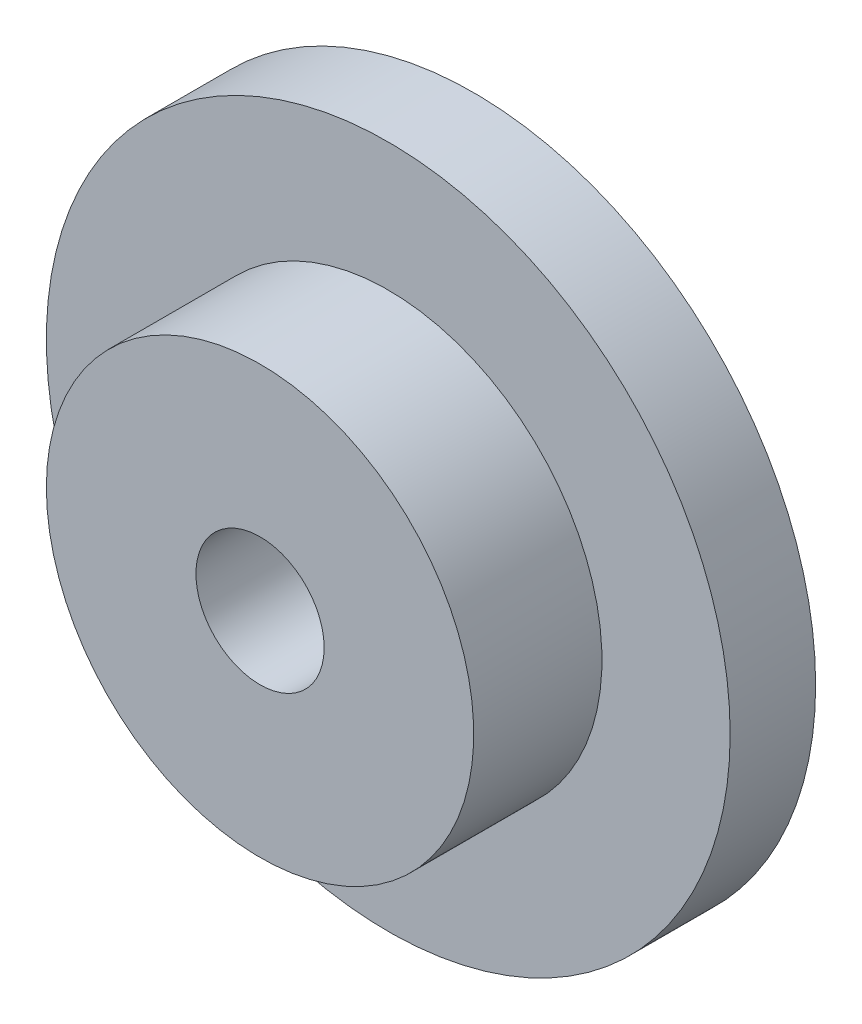
from build123d import *

# Parameters (mm, degrees)
SKETCH1_R           = 25.4
BOSS_EXTRUDE1_DEPTH = 6.35
SKETCH2_R           = 15.875
BOSS_EXTRUDE2_DEPTH = 9.525
SKETCH3_R           = 4.7625
CUT_EXTRUDE1_DEPTH  = 15.875


with BuildPart() as part:
    # Sketch1 → Boss-Extrude1 (new body)
    with BuildSketch(Plane.XY):
        Circle(SKETCH1_R)
    extrude(amount=BOSS_EXTRUDE1_DEPTH)

    # Sketch2 → Boss-Extrude2 (add)
    with BuildSketch(Plane.XY.offset(6.35)):
        with Locations(Location((0, 0, 0), (0, 0, 180))):
            Circle(SKETCH2_R)
    extrude(amount=BOSS_EXTRUDE2_DEPTH)

    # Sketch3 → Cut-Extrude1 (cut)
    with BuildSketch(Plane.XY.offset(15.875)):
        Circle(SKETCH3_R)
    extrude(amount=-CUT_EXTRUDE1_DEPTH, mode=Mode.SUBTRACT)


solid = part.part
